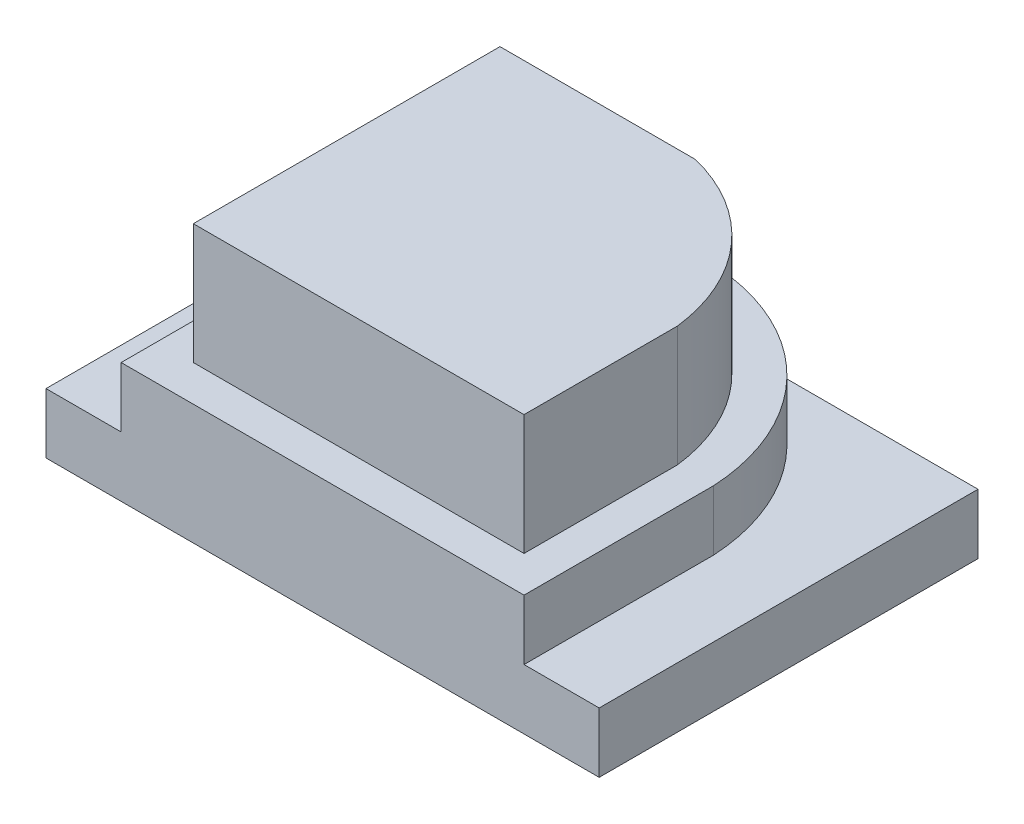
from build123d import *

# Parameters (mm, degrees)
BOSS_EXTRUDE2_DEPTH = 2
BOSS_EXTRUDE3_DEPTH = 1
SKETCH4_W           = 9.2
SKETCH4_H           = 6.3
BOSS_EXTRUDE4_DEPTH = 1


with BuildPart() as part:
    # Sketch2 → Boss-Extrude2 (new body)
    with BuildSketch(Plane(origin=(0, 0, 0), x_dir=(1, 0, 0), z_dir=(0, 1, 0))):
        with BuildLine():
            Line((-2.5, 5.35), (-5.75, 5.35))
            Line((-5.75, 5.35), (-5.75, 2.8))
            Line((-5.75, 2.8), (-5.75, 0.25))
            Line((-5.75, 0.25), (-0.25, 0.25))
            Line((-0.25, 0.25), (-0.25, 2.8))
            ThreePointArc((-0.25, 2.8), (-0.977233386, 4.425970541), (-2.5, 5.35))
        make_face()
    extrude(amount=BOSS_EXTRUDE2_DEPTH)

    # Sketch3 → Boss-Extrude3 (add)
    with BuildSketch(Plane.XZ):
        with BuildLine():
            Line((-6.35, 0.35), (0.35, 0.35))
            Line((0.35, 0.35), (0.35, -2.8))
            ThreePointArc((0.35, -2.8), (-0.515014693, -4.881653373), (-2.5, -5.95))
            Line((-2.5, -5.95), (-6.35, -5.95))
            Line((-6.35, -5.95), (-6.35, 0.35))
        make_face()
    extrude(amount=BOSS_EXTRUDE3_DEPTH)

    # Sketch4 → Boss-Extrude4 (add)
    with BuildSketch(Plane.XZ.offset(1)):
        with Locations((-3, -2.8)):
            Rectangle(SKETCH4_W, SKETCH4_H)
    extrude(amount=BOSS_EXTRUDE4_DEPTH)


solid = part.part
